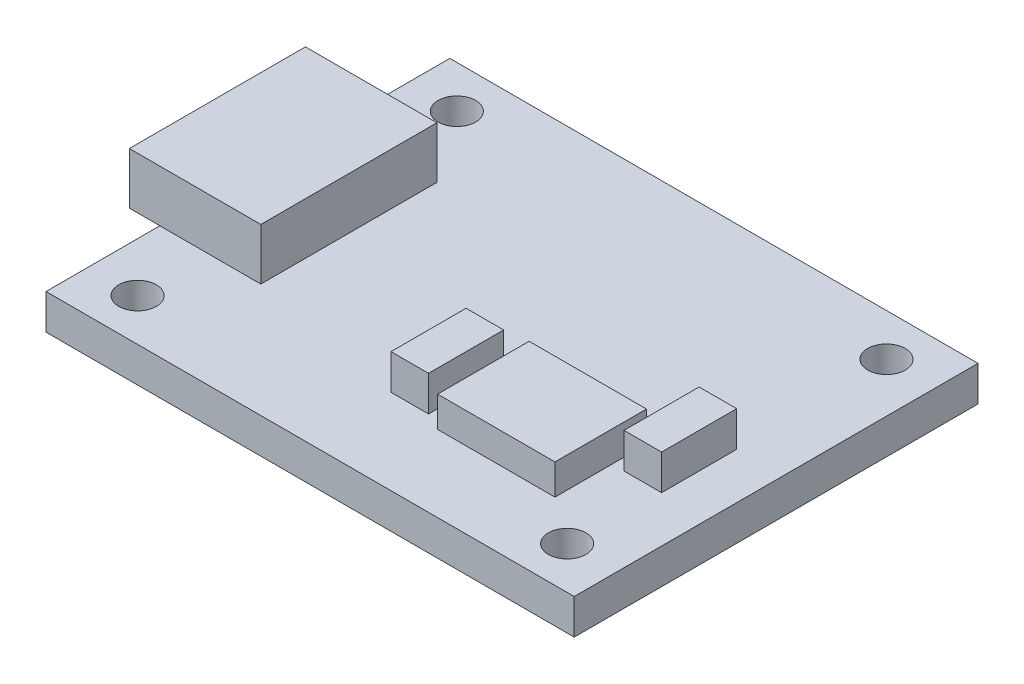
from build123d import *

# Parameters (mm, degrees)
SKETCH1_W           = 22.5
SKETCH1_H           = 17.2
BOSS_EXTRUDE1_DEPTH = 1.5
SKETCH2_W           = 1.6
SKETCH2_H           = 3.2
BOSS_EXTRUDE2_DEPTH = 1.5
SKETCH2_3_W         = 5
SKETCH2_3_H         = 3.9
BOSS_EXTRUDE3_DEPTH = 1.3
SKETCH3_W           = 5.6
SKETCH3_H           = 7.5
BOSS_EXTRUDE4_DEPTH = 2.2
SKETCH4_R           = 0.8
CUT_EXTRUDE1_DEPTH  = 16.657346518


with BuildPart() as part:
    # Sketch1 → Boss-Extrude1 (new body)
    with BuildSketch(Plane(origin=(0, 0, 0), x_dir=(1, 0, 0), z_dir=(0, 1, 0))):
        Rectangle(SKETCH1_W, SKETCH1_H)
    extrude(amount=BOSS_EXTRUDE1_DEPTH)

    # Sketch2 → Boss-Extrude2 (add)
    with BuildSketch(Plane(origin=(0, 1.5, 0), x_dir=(1, 0, 0), z_dir=(0, 1, 0))):
        with Locations((8.482597382, -1.31074558)):
            Rectangle(SKETCH2_W, SKETCH2_H)
        with Locations((0.614877172, -3.370237047)):
            Rectangle(SKETCH2_W, SKETCH2_H)
    extrude(amount=BOSS_EXTRUDE2_DEPTH)

    # Sketch2<3> → Boss-Extrude3 (add)
    with BuildSketch(Plane(origin=(0, 1.5, 0), x_dir=(1, 0, 0), z_dir=(0, 1, 0))):
        with Locations((4.675193235, -3.396272098)):
            Rectangle(SKETCH2_3_W, SKETCH2_3_H)
    extrude(amount=BOSS_EXTRUDE3_DEPTH)

    # Sketch3 → Boss-Extrude4 (add)
    with BuildSketch(Plane(origin=(0, 1.5, 0), x_dir=(1, 0, 0), z_dir=(0, 1, 0))):
        with Locations((-9.75, 0)):
            Rectangle(SKETCH3_W, SKETCH3_H)
    extrude(amount=BOSS_EXTRUDE4_DEPTH)

    # Sketch4 → Cut-Extrude1 (cut, through all)
    with BuildSketch(Plane(origin=(0, 0, 0), x_dir=(1, 0, 0), z_dir=(0, 1, 0))):
        with Locations((-9.15, 6.8)):
            Circle(SKETCH4_R)
        with Locations((-9.15, -6.8)):
            Circle(SKETCH4_R)
        with Locations((9.15, -6.8)):
            Circle(SKETCH4_R)
        with Locations((9.15, 6.8)):
            Circle(SKETCH4_R)
    extrude(amount=CUT_EXTRUDE1_DEPTH, mode=Mode.SUBTRACT)


solid = part.part
